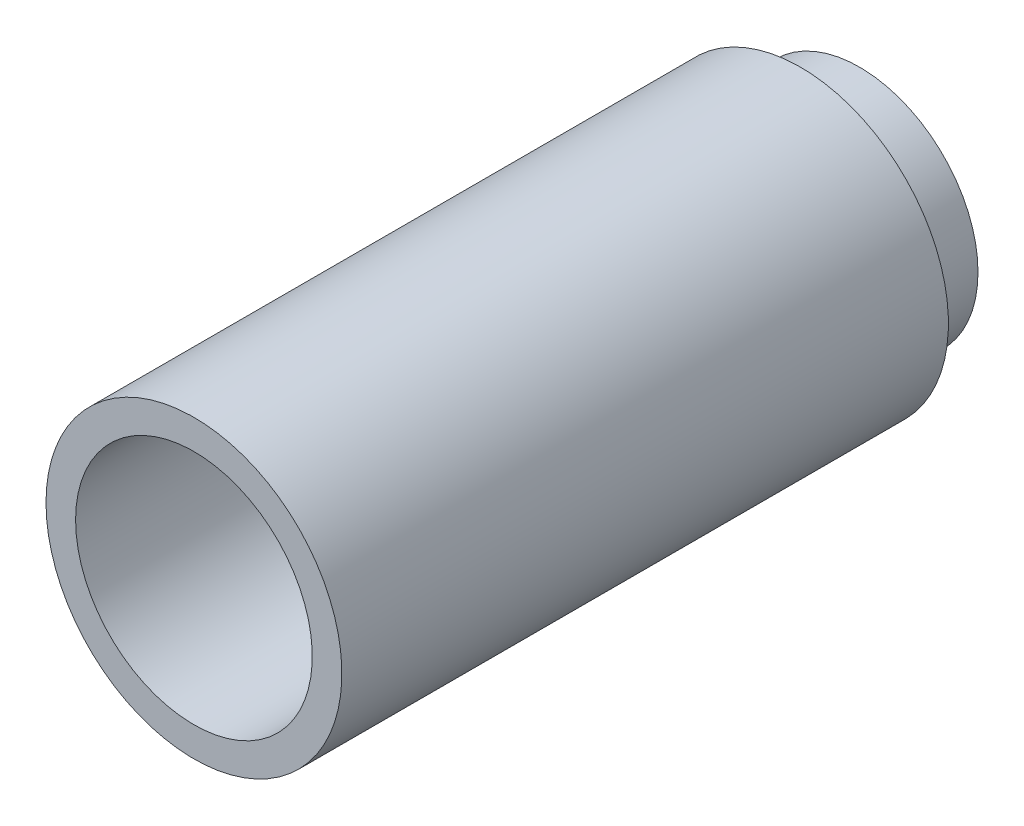
from build123d import *

# Parameters (mm, degrees)
SKETCH_1_R      = 40
SKETCH_1_R_2    = 35
EXTRUDE_1_DEPTH = 20
SKETCH_2_R      = 50
SKETCH_2_R_2    = 40
EXTRUDE_3_DEPTH = 205


with BuildPart() as part:
    # 草图1 → 凸台-拉伸1 (new body)
    with BuildSketch(Plane.XY):
        Circle(SKETCH_1_R)
        Circle(SKETCH_1_R_2, mode=Mode.SUBTRACT)
    extrude(amount=EXTRUDE_1_DEPTH)


with BuildPart() as body_2:
    # 草图2 → 凸台-拉伸3 (new body)
    with BuildSketch(Plane.XY.offset(20)):
        with Locations(Location((0, 0, 0), (0, 0, 180))):
            Circle(SKETCH_2_R)
        with Locations(Location((0, 0, 0), (0, 0, 180))):
            Circle(SKETCH_2_R_2, mode=Mode.SUBTRACT)
    extrude(amount=EXTRUDE_3_DEPTH)


solid = Compound([part.part, body_2.part])
